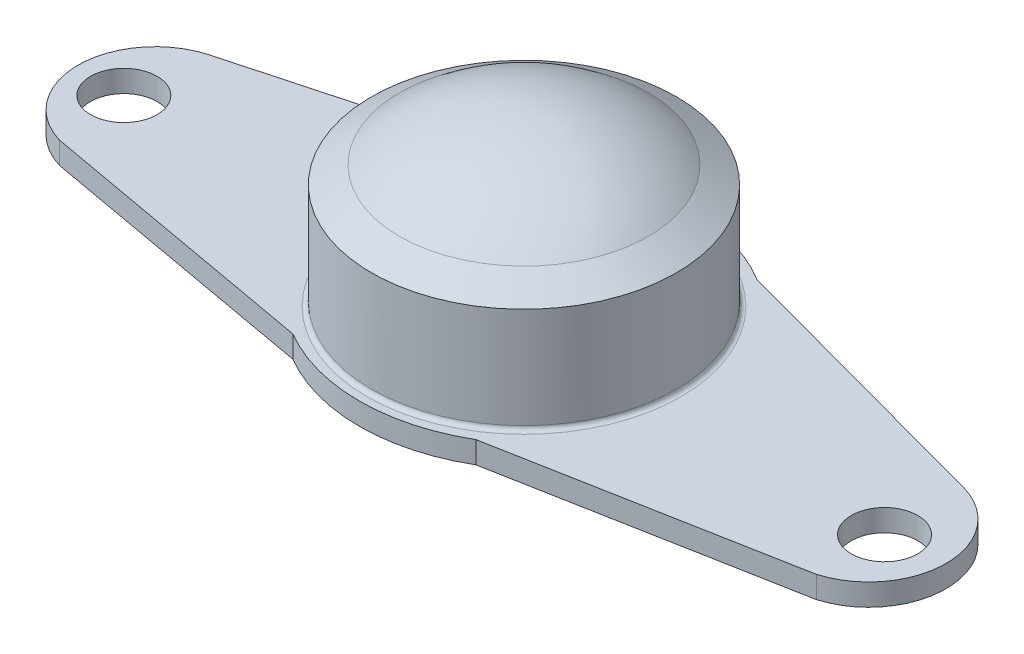
from build123d import *

# Parameters (mm, degrees)
BOSS_EXTRUDE2_DEPTH = 2.5
SKETCH3_R           = 17.40366437
BOSS_EXTRUDE3_DEPTH = 14
CHAMFER1_SIZE       = 2
CHAMFER1_SIZE2      = 3.200669058
DOME1_FACE_RADIUS   = 14.202995312
DOME1_HEIGHT        = 5.08
SKETCH4_R           = 3.794155
SKETCH4_R_2         = 3.79415255
CUT_EXTRUDE1_DEPTH  = 22.225
FILLET1_R           = 0.5


with BuildPart() as part:
    # Sketch2 → Boss-Extrude2 (new body)
    with BuildSketch(Plane(origin=(0, 0, 0), x_dir=(1, 0, 0), z_dir=(0, 1, 0))):
        with BuildLine():
            Line((-35.297990867, 36.146423133), (-67.605962497, 27.389534463))
            ThreePointArc((-67.605962497, 27.389534463), (-74.11985651, 18.96683835), (-67.783839922, 10.40953043))
            Line((-67.783839922, 10.40953043), (-35.297990867, 4.567846601))
            ThreePointArc((-35.297990867, 4.567846601), (-24.860460433, 1.727880743), (-14.422929998, 4.567846601))
            Line((-14.422929998, 4.567846601), (16.577836549, 10.352015281))
            Line((16.577836549, 10.352015281), (18.329761229, 10.678891968))
            ThreePointArc((18.329761229, 10.678891968), (24.665777818, 19.236199887), (18.151883804, 27.658896001))
            Line((18.151883804, 27.658896001), (-14.156087825, 36.415784671))
            ThreePointArc((-14.156087825, 36.415784671), (-24.766013326, 39.340130463), (-35.297990867, 36.146423133))
        make_face()
    extrude(amount=BOSS_EXTRUDE2_DEPTH)

    # Sketch3 → Boss-Extrude3 (add)
    with BuildSketch(Plane(origin=(0, 2.5, 0), x_dir=(1, 0, 0), z_dir=(0, 1, 0))):
        with Locations(Location((-24.847892724, 20.495392169, 0), (0, 0, 90))):
            Circle(SKETCH3_R)
    extrude(amount=BOSS_EXTRUDE3_DEPTH)

    # Chamfer1
    chamfer1_edges = [part.edges().sort_by_distance(p)[0] for p in [
        (-24.847892724, 16.5, -3.0917278),
    ]]
    chamfer1_side = [part.faces().sort_by_distance(p)[0] for p in [
        (-24.847892724, 9.5, -3.0917278),
    ]]
    chamfer(chamfer1_edges, length=CHAMFER1_SIZE, length2=CHAMFER1_SIZE2, reference=chamfer1_side[0])

    # Dome1: a dome of height H over a round flat face of radius A is a cap of a sphere of radius (A * A + H * H) / (2 * H)
    dome1_r = (DOME1_FACE_RADIUS * DOME1_FACE_RADIUS + DOME1_HEIGHT * DOME1_HEIGHT) / (2 * DOME1_HEIGHT)
    dome1_base = Plane((-24.847892724, 16.5, -20.495392169), z_dir=(0, 1, 0))
    with Locations(dome1_base.offset(DOME1_HEIGHT - dome1_r)):
        dome1_ball = Sphere(dome1_r, mode=Mode.PRIVATE)
    add(split(dome1_ball, bisect_by=dome1_base, keep=Keep.TOP, mode=Mode.PRIVATE))

    # Sketch4 → Cut-Extrude1 (cut)
    with BuildSketch(Plane(origin=(0, 2.5, 0), x_dir=(1, 0, 0), z_dir=(0, 1, 0))):
        with Locations(Location((18.303486059, 18.493262314, 0), (0, 0, 270))):
            Circle(SKETCH4_R)
        with Locations(Location((-68.509987209, 18.493262314, 0), (0, 0, 270))):
            Circle(SKETCH4_R_2)
    extrude(amount=-CUT_EXTRUDE1_DEPTH, mode=Mode.SUBTRACT)

    # Fillet1
    fillet1_edges = [part.edges().sort_by_distance(p)[0] for p in [
        (-24.847892724, 2.5, -3.0917278),
    ]]
    fillet(fillet1_edges, radius=FILLET1_R)


solid = part.part
